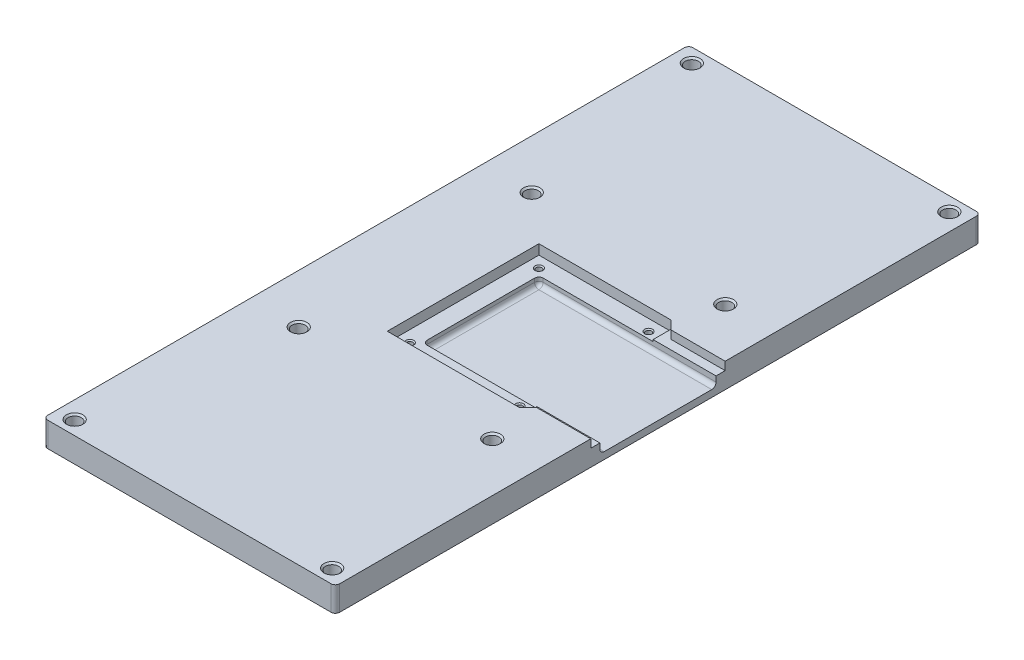
from build123d import *

# Parameters (mm, degrees)
BOSS_EXTRUDE1_DEPTH     = 11.5
SKETCH4_R               = 3.075
CUT_EXTRUDE1_DEPTH      = 6
CUT_EXTRUDE6_DEPTH      = 4.6
CUT_EXTRUDE3_DEPTH      = 165.786606328
CUT_EXTRUDE3_DEPTH_BACK = 3.7
SKETCH24_W              = 82.375
SKETCH24_H              = 54
SKETCH25_R              = 1.35
CUT_EXTRUDE4_DEPTH      = 5
CHAMFER4_SIZE           = 0.5
FILLET1_R               = 2
BOSS_EXTRUDE2_DEPTH     = 0.8
CHAMFER5_SIZE           = 0.75


with BuildPart() as part:
    # Sketch1 → Boss-Extrude1 (new body)
    with BuildSketch(Plane(origin=(0, 0, 0), x_dir=(1, 0, 0), z_dir=(0, 1, 0))):
        with BuildLine():
            Line((-67.875, 135), (-67.875, -135))
            Line((-67.875, -135), (-67.875, -148))
            ThreePointArc((-67.875, -148), (-67.289213562, -149.414213562), (-65.875, -150))
            Line((-65.875, -150), (65.875, -150))
            ThreePointArc((65.875, -150), (67.289213562, -149.414213562), (67.875, -148))
            Line((67.875, -148), (67.875, -135))
            Line((67.875, -135), (67.875, 135))
            Line((67.875, 135), (67.875, 148))
            ThreePointArc((67.875, 148), (67.289213562, 149.414213562), (65.875, 150))
            Line((65.875, 150), (-65.875, 150))
            ThreePointArc((-65.875, 150), (-67.289213562, 149.414213562), (-67.875, 148))
            Line((-67.875, 148), (-67.875, 135))
        make_face()
    extrude(amount=BOSS_EXTRUDE1_DEPTH)

    # Sketch4 → Cut-Extrude1 (cut)
    with BuildSketch(Plane(origin=(0, 11.5, 0), x_dir=(1, 0, 0), z_dir=(0, 1, 0))):
        with Locations(Location((-59.875, -143.5, 0), (0, 0, 270))):
            Circle(SKETCH4_R)
        with Locations(Location((59.875, -143.5, 0), (0, 0, 270))):
            Circle(SKETCH4_R)
        with Locations(Location((59.875, 143.5, 0), (0, 0, 270))):
            Circle(SKETCH4_R)
        with Locations(Location((-59.875, 143.5, 0), (0, 0, 270))):
            Circle(SKETCH4_R)
        with Locations(Location((45, -54.175, 0), (0, 0, 270))):
            Circle(SKETCH4_R)
        with Locations(Location((-45, -54.175, 0), (0, 0, 270))):
            Circle(SKETCH4_R)
        with Locations(Location((45, 54.175, 0), (0, 0, 270))):
            Circle(SKETCH4_R)
        with Locations(Location((-45, 54.175, 0), (0, 0, 270))):
            Circle(SKETCH4_R)
    extrude(amount=-CUT_EXTRUDE1_DEPTH, mode=Mode.SUBTRACT)

    # Sketch21 → Cut-Extrude6 (cut)
    with BuildSketch(Plane(origin=(0, 11.5, 0), x_dir=(1, 0, 0), z_dir=(0, 1, 0))):
        Polygon((67.875, 31), (67.875, -31), (67.875, -31.25), (42.603553391, -31.25), (38.603553391, -35.25), (-22.75, -35.25), (-22.75, 35.25), (38.603553391, 35.25), (42.603553391, 31.25), (67.875, 31.25), align=None)
    extrude(amount=-CUT_EXTRUDE6_DEPTH, mode=Mode.SUBTRACT)

    # Sketch24 → Cut-Extrude3 (cut, two sides: drawn at the far end of the back side and taken through both)
    with BuildSketch(Plane(origin=(0, 6.9, 0), x_dir=(1, 0, 0), z_dir=(0, 1, 0)).offset(-CUT_EXTRUDE3_DEPTH_BACK)):
        with Locations((26.6875, 0)):
            Rectangle(SKETCH24_W, SKETCH24_H)
    extrude(amount=CUT_EXTRUDE3_DEPTH + CUT_EXTRUDE3_DEPTH_BACK, mode=Mode.SUBTRACT)

    # Sketch25 → Cut-Extrude4 (cut)
    with BuildSketch(Plane(origin=(0, 6.9, 0), x_dir=(1, 0, 0), z_dir=(0, 1, 0))):
        with Locations(Location((33.5, 30, 0), (0, 0, 270))):
            Circle(SKETCH25_R)
        with Locations(Location((-17.5, 30, 0), (0, 0, 270))):
            Circle(SKETCH25_R)
        with Locations(Location((33.5, -30, 0), (0, 0, 270))):
            Circle(SKETCH25_R)
        with Locations(Location((-17.5, -30, 0), (0, 0, 270))):
            Circle(SKETCH25_R)
    extrude(amount=-CUT_EXTRUDE4_DEPTH, mode=Mode.SUBTRACT)

    # Chamfer4
    chamfer4_edges = [part.edges().sort_by_distance(p)[0] for p in [
        (-17.5, 6.9, -31.35),
        (33.5, 6.9, 28.65),
        (-17.5, 6.9, 28.65),
        (33.5, 6.9, -31.35),
    ]]
    chamfer(chamfer4_edges, length=CHAMFER4_SIZE)

    # Fillet1
    fillet1_edges = [part.edges().sort_by_distance(p)[0] for p in [
        (26.6875, 3.2, -27),
        (-14.5, 5.05, -27),
        (-14.5, 3.2, 0),
        (-14.5, 5.05, 27),
        (26.6875, 3.2, 27),
    ]]
    fillet(fillet1_edges, radius=FILLET1_R)

    # Sketch26 → Boss-Extrude2 (add)
    with BuildSketch(Plane(origin=(0, 6.9, 0), x_dir=(1, 0, 0), z_dir=(0, 1, 0))):
        Polygon((38.603553391, 35.25), (38.603553391, 27), (67.875, 27), (67.875, 31.25), (42.603553391, 31.25), align=None)
        Polygon((42.603553391, -31.25), (38.603553391, -35.25), (38.603553391, -27), (67.875, -27), (67.875, -31.25), align=None)
    extrude(amount=BOSS_EXTRUDE2_DEPTH)

    # Chamfer5
    chamfer5_edges = [part.edges().sort_by_distance(p)[0] for p in [
        (59.875, 11.5, 140.425),
        (59.875, 11.5, -146.575),
        (45, 11.5, 51.1),
        (-45, 11.5, 51.1),
        (-45, 11.5, -57.25),
        (45, 11.5, -57.25),
        (-59.875, 11.5, -146.575),
        (-59.875, 11.5, 140.425),
    ]]
    chamfer(chamfer5_edges, length=CHAMFER5_SIZE)


solid = part.part
